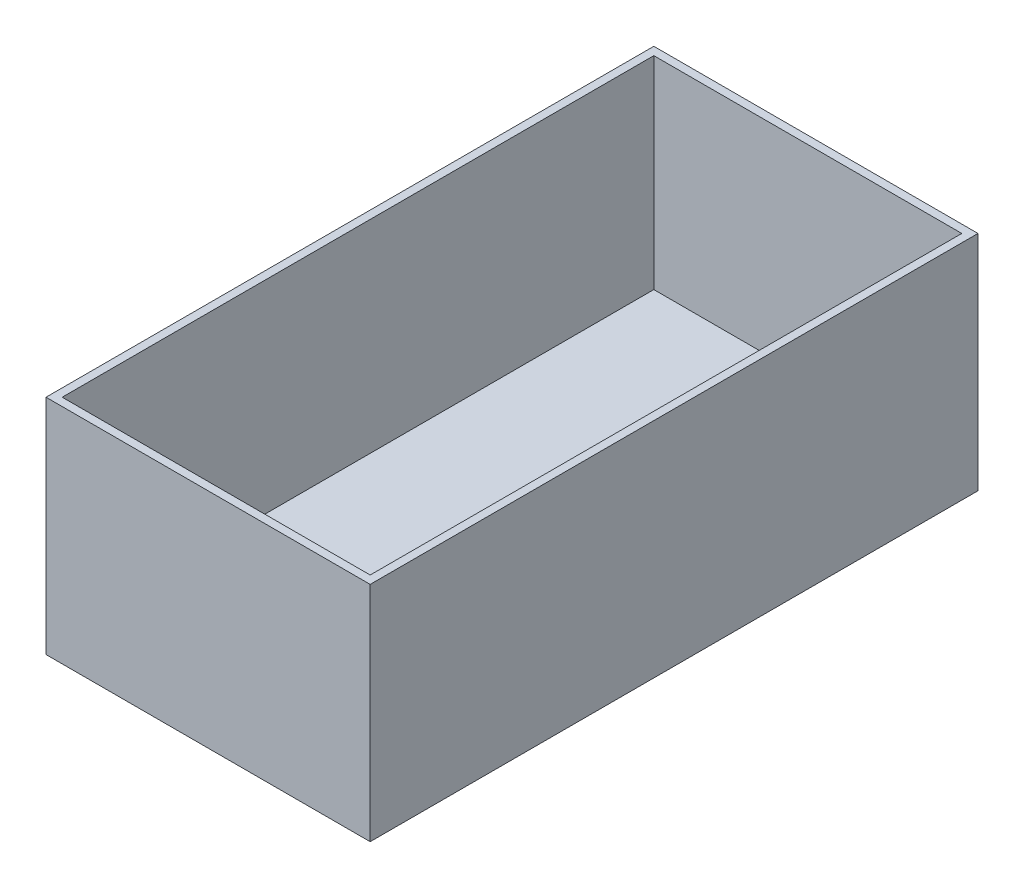
from build123d import *

# Parameters (mm, degrees)
SKETCH1_W           = 80
SKETCH1_H           = 150
BOSS_EXTRUDE1_DEPTH = 5
SKETCH2_W           = 80
SKETCH2_H           = 150
SKETCH2_W_2         = 76
SKETCH2_H_2         = 146
BOSS_EXTRUDE2_DEPTH = 50


with BuildPart() as part:
    # Sketch1 → Boss-Extrude1 (new body)
    with BuildSketch(Plane(origin=(0, 0, 0), x_dir=(1, 0, 0), z_dir=(0, 1, 0))):
        Rectangle(SKETCH1_W, SKETCH1_H)
    extrude(amount=BOSS_EXTRUDE1_DEPTH)

    # Sketch2 → Boss-Extrude2 (add)
    with BuildSketch(Plane(origin=(0, 5, 0), x_dir=(1, 0, 0), z_dir=(0, 1, 0))):
        Rectangle(SKETCH2_W, SKETCH2_H)
        Rectangle(SKETCH2_W_2, SKETCH2_H_2, mode=Mode.SUBTRACT)
    extrude(amount=BOSS_EXTRUDE2_DEPTH)


solid = part.part
